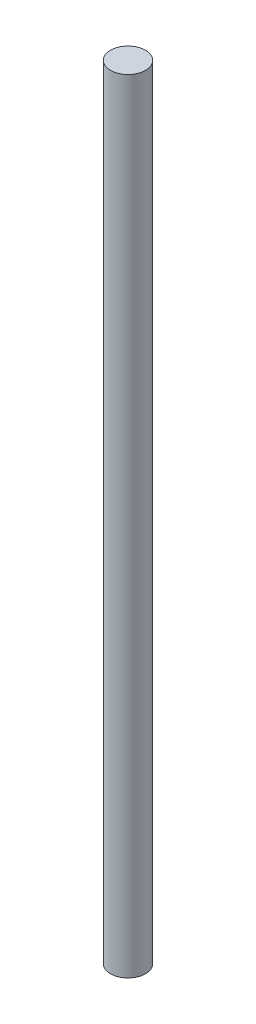
from build123d import *

# Parameters (mm, degrees)
SKETCH1_R           = 3.35
BOSS_EXTRUDE1_DEPTH = 150


with BuildPart() as part:
    # Sketch1 → Boss-Extrude1 (new body)
    with BuildSketch(Plane(origin=(0, 0, 0), x_dir=(1, 0, 0), z_dir=(0, 1, 0))):
        with Locations(Location((0, 0, 0), (0, 0, 270))):
            Circle(SKETCH1_R)
    extrude(amount=BOSS_EXTRUDE1_DEPTH)


solid = part.part
